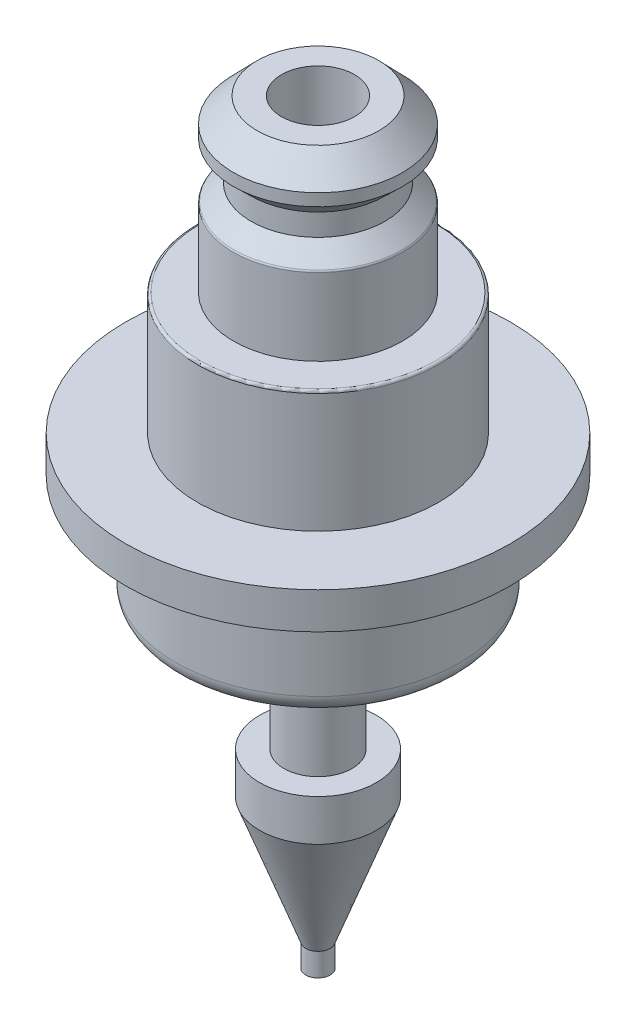
from build123d import *

# Parameters (mm, degrees)
SKETCH_2_R      = 0.5
SKETCH_2_R_2    = 0.15
EXTRUDE_1_DEPTH = 1


with BuildPart() as part:
    # 草图1 → 旋转1 (revolve)
    with BuildSketch(Plane.XY):
        with BuildLine():
            Line((2.4, -9.75), (1.4, -9.75))
            Line((1.4, -9.75), (1.4, -4.5))
            Line((1.4, -4.5), (5.1, -4.5))
            ThreePointArc((5.1, -4.5), (5.630330086, -4.280330086), (5.85, -3.75))
            Line((5.85, -3.75), (5.85, 0))
            Line((5.85, 0), (7.9, 0))
            Line((7.9, 0), (7.9, 1.5))
            Line((7.9, 1.5), (4.955, 1.5))
            Line((4.955, 1.5), (4.955, 6.4))
            ThreePointArc((4.955, 6.4), (4.925710678, 6.470710678), (4.855, 6.5))
            Line((4.855, 6.5), (3.475, 6.5))
            Line((3.475, 6.5), (3.475, 9.65754728))
            ThreePointArc((3.475, 9.65754728), (3.467048751, 9.696624479), (3.444459451, 9.729487426))
            Line((3.444459451, 9.729487426), (2.75, 10.4))
            Line((2.75, 10.4), (2.75, 11.3))
            Line((2.75, 11.3), (3.475, 12))
            Line((3.475, 12), (3.475, 12.5))
            Line((3.475, 12.5), (2.5, 13.5))
            Line((2.5, 13.5), (1.5, 13.5))
            Line((1.5, 13.5), (1.5, 0))
            Line((1.5, 0), (0.15, 0))
            Line((0.15, 0), (0.15, -17.55))
            Line((0.15, -17.55), (2.4, -11.45))
            Line((2.4, -11.45), (2.4, -9.75))
        make_face()
    revolve(axis=Axis((0, 13.5, 0), (0, -1, 0)))

    # 草图2 → 凸台-拉伸1 (add)
    with BuildSketch(Plane(origin=(0, -17.55, 0), x_dir=(-1, 0, 0), z_dir=(0, -1, 0))):
        Circle(SKETCH_2_R)
        Circle(SKETCH_2_R_2, mode=Mode.SUBTRACT)
    extrude(amount=-EXTRUDE_1_DEPTH)


solid = part.part
